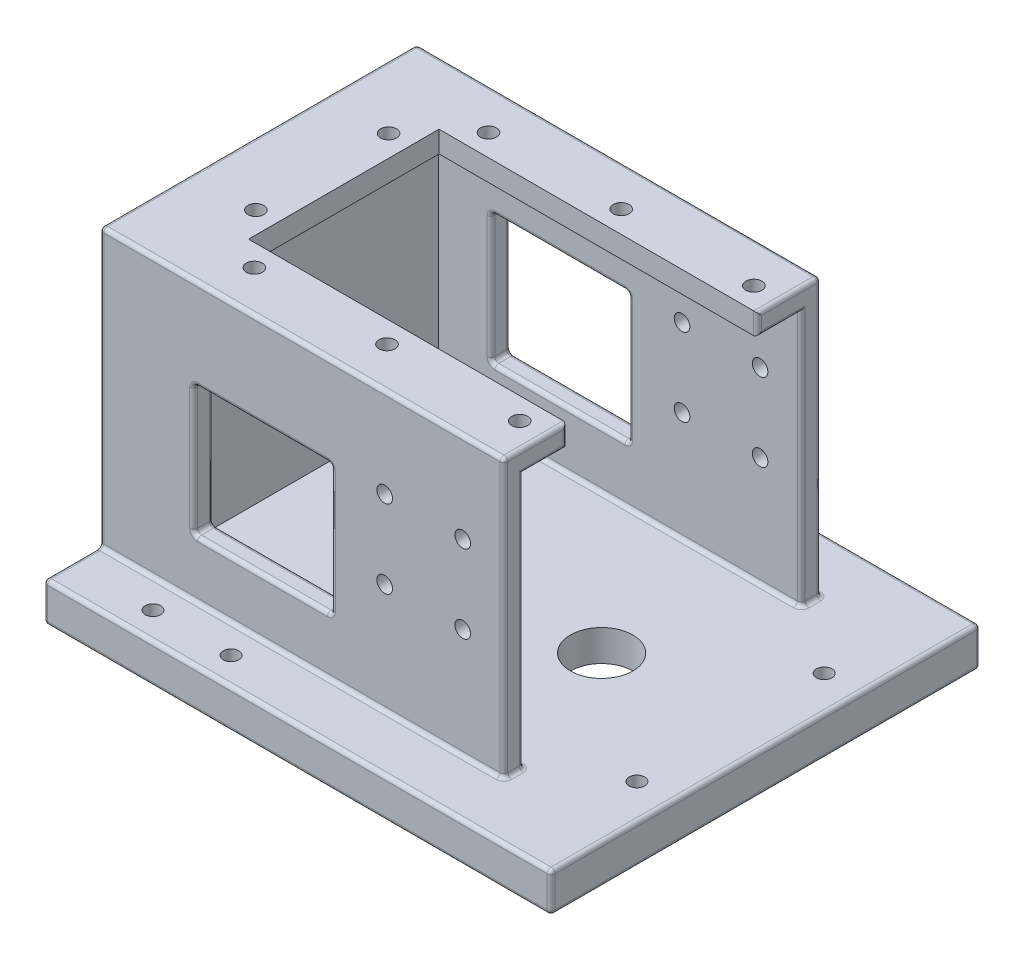
from build123d import *

# Parameters (mm, degrees)
SKETCH1_W           = 65
SKETCH1_H           = 55
SKETCH1_R           = 4
BOSS_EXTRUDE1_DEPTH = 5
SKETCH5_R           = 12.5
CUT_EXTRUDE3_DEPTH  = 1
BOSS_EXTRUDE2_DEPTH = 35.5
BOSS_EXTRUDE4_DEPTH = 2.75
SKETCH12_R          = 1.025
CUT_EXTRUDE4_DEPTH  = 2.75
SKETCH13_W          = 17.643630177
SKETCH13_H          = 16.669982459
CUT_EXTRUDE6_DEPTH  = 345.955217573
FILLET1_R           = 0.5
SKETCH14_R          = 1
CUT_EXTRUDE7_DEPTH  = 345.955217573
SKETCH15_R          = 1
CUT_EXTRUDE8_DEPTH  = 63.858888163


with BuildPart() as part:
    # Sketch1 → Boss-Extrude1 (new body)
    with BuildSketch(Plane(origin=(0, 298.283887323, 0), x_dir=(1, 0, 0), z_dir=(0, 1, 0))):
        with Locations((-11.485677455, 0)):
            Rectangle(SKETCH1_W, SKETCH1_H)
        with Locations(Location((0, 0, 0), (0, 0, 270))):
            Circle(SKETCH1_R, mode=Mode.SUBTRACT)
    extrude(amount=BOSS_EXTRUDE1_DEPTH)

    # Sketch5 → Cut-Extrude3 (cut)
    with BuildSketch(Plane.XZ.offset(-298.283887323)):
        with Locations(Location((0, 0, 0), (0, 0, 270))):
            Circle(SKETCH5_R)
    extrude(amount=-CUT_EXTRUDE3_DEPTH, mode=Mode.SUBTRACT)

    # Sketch6 → Boss-Extrude2 (add)
    with BuildSketch(Plane(origin=(0, 303.283887323, 0), x_dir=(1, 0, 0), z_dir=(0, 1, 0))):
        Polygon((7.769706862, 17.8), (7.769706862, 20.3), (-43.985677455, 20.3), (-43.985677455, -20.3), (7.769706862, -20.3), (7.769706862, -17.8), (-38.689340861, -17.8), (-38.689340861, 17.8), align=None)
    extrude(amount=BOSS_EXTRUDE2_DEPTH)

    # Sketch11 → Boss-Extrude4 (add)
    with BuildSketch(Plane(origin=(0, 338.783887323, 0), x_dir=(1, 0, 0), z_dir=(0, 1, 0))):
        Polygon((7.769706862, 17.8), (7.769706862, 12.2), (-33.035634981, 12.2), (-33.035634981, -12.2), (7.769706862, -12.2), (7.769706862, -17.8), (-40.37376825, -17.8), (-40.37376825, 17.8), align=None)
    extrude(amount=-BOSS_EXTRUDE4_DEPTH)

    # Sketch12 → Cut-Extrude4 (cut)
    with BuildSketch(Plane(origin=(0, 338.783887323, 0), x_dir=(1, 0, 0), z_dir=(0, 1, 0))):
        with Locations(Location((4.5, -15, 0), (0, 0, 270))):
            Circle(SKETCH12_R)
        with Locations(Location((-12.5, -15, 0), (0, 0, 270))):
            Circle(SKETCH12_R)
        with Locations(Location((-29.5, -15, 0), (0, 0, 270))):
            Circle(SKETCH12_R)
        with Locations(Location((-35.8, -8.5, 0), (0, 0, 270))):
            Circle(SKETCH12_R)
        with Locations(Location((-35.8, 8.5, 0), (0, 0, 270))):
            Circle(SKETCH12_R)
        with Locations(Location((-29.5, 15, 0), (0, 0, 270))):
            Circle(SKETCH12_R)
        with Locations(Location((4.5, 15, 0), (0, 0, 270))):
            Circle(SKETCH12_R)
        with Locations(Location((-12.5, 15, 0), (0, 0, 270))):
            Circle(SKETCH12_R)
    extrude(amount=-CUT_EXTRUDE4_DEPTH, mode=Mode.SUBTRACT)

    # Sketch13 → Cut-Extrude6 (cut, through all)
    with BuildSketch(Plane.XY.offset(20.3)):
        with Locations((-23.153184912, 318.868878553)):
            Rectangle(SKETCH13_W, SKETCH13_H)
    extrude(amount=-CUT_EXTRUDE6_DEPTH, mode=Mode.SUBTRACT)

    # Fillet1
    fillet1_edges = [part.edges().sort_by_distance(p)[0] for p in [
        (-31.975, 310.533887323, -19.05),
        (-31.975, 318.868878553, -17.8),
        (-31.975, 318.868878553, -20.3),
        (-31.975, 318.868878553, 17.8),
        (-31.975, 310.533887323, 19.05),
        (-31.975, 327.203869782, -19.05),
        (-23.153184912, 327.203869782, -17.8),
        (-23.153184912, 327.203869782, -20.3),
        (-23.153184912, 327.203869782, 17.8),
        (-31.975, 327.203869782, 19.05),
        (-14.331369823, 327.203869782, -19.05),
        (-14.331369823, 318.868878553, -17.8),
        (-14.331369823, 318.868878553, -20.3),
        (-14.331369823, 318.868878553, 17.8),
        (-14.331369823, 327.203869782, 19.05),
        (-14.331369823, 310.533887323, -19.05),
        (-23.153184912, 310.533887323, -17.8),
        (-23.153184912, 310.533887323, -20.3),
        (-23.153184912, 310.533887323, 17.8),
        (-14.331369823, 310.533887323, 19.05),
        (-31.975, 318.868878553, 20.3),
        (-23.153184912, 310.533887323, 20.3),
        (-14.331369823, 318.868878553, 20.3),
        (-23.153184912, 327.203869782, 20.3),
        (21.014322545, 303.283887323, 0),
        (-11.485677455, 303.283887323, -27.5),
        (0, 299.283887323, 12.5),
        (-43.985677455, 303.283887323, 23.9),
        (-15.459816999, 303.283887323, -17.8),
        (7.769706862, 303.283887323, -19.05),
        (7.769706862, 321.033887323, -20.3),
        (-18.107985296, 303.283887323, -20.3),
        (-43.985677455, 321.033887323, -20.3),
        (-43.985677455, 321.033887323, 20.3),
        (-18.107985296, 303.283887323, 20.3),
        (7.769706862, 321.033887323, 20.3),
        (7.769706862, 303.283887323, 19.05),
        (-15.459816999, 303.283887323, 17.8),
        (7.769706862, 338.783887323, -16.25),
        (-18.107985296, 338.783887323, -20.3),
        (-43.985677455, 338.783887323, 0),
        (-18.107985296, 338.783887323, 20.3),
        (7.769706862, 338.783887323, 16.25),
        (-43.985677455, 303.283887323, -23.9),
        (-11.485677455, 298.283887323, -27.5),
        (7.769706862, 319.658887323, 17.8),
        (7.769706862, 319.658887323, -17.8),
        (21.014322545, 298.283887323, 0),
        (7.769706862, 336.033887323, -15),
        (7.769706862, 337.408887323, -12.2),
        (7.769706862, 336.033887323, 15),
        (-11.485677455, 298.283887323, 27.5),
        (7.769706862, 337.408887323, 12.2),
        (-43.985677455, 298.283887323, 0),
        (-43.985677455, 300.783887323, -27.5),
        (21.014322545, 300.783887323, -27.5),
        (21.014322545, 300.783887323, 27.5),
        (-43.985677455, 300.783887323, 27.5),
        (-11.485677455, 303.283887323, 27.5),
    ]]
    fillet(fillet1_edges, radius=FILLET1_R)

    # Sketch14 → Cut-Extrude7 (cut, through all)
    with BuildSketch(Plane.XY.offset(20.3)):
        with Locations((-7.5, 327.30682762)):
            Circle(SKETCH14_R)
        with Locations((2.5, 327.30682762)):
            Circle(SKETCH14_R)
        with Locations((2.5, 317.30682762)):
            Circle(SKETCH14_R)
        with Locations((-7.5, 317.30682762)):
            Circle(SKETCH14_R)
    extrude(amount=-CUT_EXTRUDE7_DEPTH, mode=Mode.SUBTRACT)

    # Sketch15 → Cut-Extrude8 (cut, through all)
    with BuildSketch(Plane(origin=(0, 303.283887323, 0), x_dir=(1, 0, 0), z_dir=(0, 1, 0))):
        with Locations(Location((-33.485677455, 24, 0), (0, 0, 270))):
            Circle(SKETCH15_R)
        with Locations(Location((-23.485677455, 24, 0), (0, 0, 270))):
            Circle(SKETCH15_R)
        with Locations(Location((-33.485677455, -24, 0), (0, 0, 270))):
            Circle(SKETCH15_R)
        with Locations(Location((-23.485677455, -24, 0), (0, 0, 270))):
            Circle(SKETCH15_R)
        with Locations(Location((16.514322545, 12, 0), (0, 0, 270))):
            Circle(SKETCH15_R)
        with Locations(Location((16.514322545, -12, 0), (0, 0, 270))):
            Circle(SKETCH15_R)
    extrude(amount=-CUT_EXTRUDE8_DEPTH, mode=Mode.SUBTRACT)


solid = part.part
